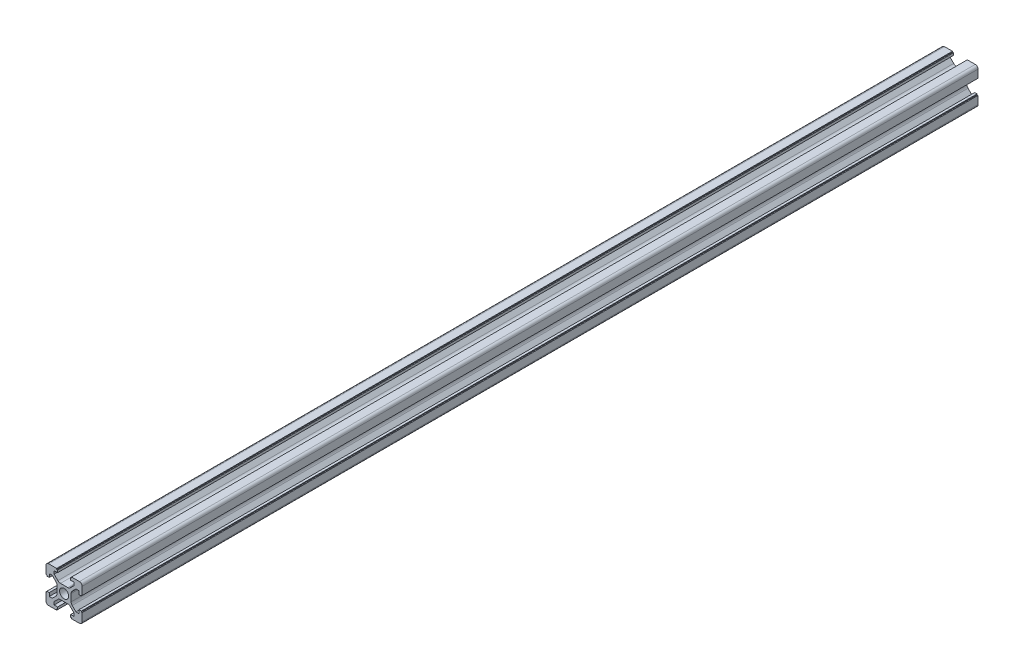
from build123d import *

# Parameters (mm, degrees)
SKETCH1_R           = 2.5
BOSS_EXTRUDE2_DEPTH = 495


with BuildPart() as part:
    # Sketch1 → Boss-Extrude2 (new body)
    with BuildSketch(Plane.XY):
        with BuildLine():
            Line((10, -4.1), (10, -8.5))
            ThreePointArc((10, -8.5), (9.560660172, -9.560660172), (8.5, -10))
            Line((8.5, -10), (4.1, -10))
            Line((4.1, -10), (4.1, -9.5))
            Line((4.1, -9.5), (3.6, -9.5))
            Line((3.6, -9.5), (3.6, -8.2))
            Line((3.6, -8.2), (5.5, -8.2))
            Line((5.5, -8.2), (5.5, -6.560660172))
            Line((5.5, -6.560660172), (3.425126266, -4.485786438))
            ThreePointArc((3.425126266, -4.485786438), (2.776279568, -4.052240935), (2.010912703, -3.9))
            Line((2.010912703, -3.9), (-2.010912703, -3.9))
            ThreePointArc((-2.010912703, -3.9), (-2.776279568, -4.052240935), (-3.425126266, -4.485786438))
            Line((-3.425126266, -4.485786438), (-5.5, -6.560660172))
            Line((-5.5, -6.560660172), (-5.5, -8.2))
            Line((-5.5, -8.2), (-3.6, -8.2))
            Line((-3.6, -8.2), (-3.6, -9.5))
            Line((-3.6, -9.5), (-4.1, -9.5))
            Line((-4.1, -9.5), (-4.1, -10))
            Line((-4.1, -10), (-8.5, -10))
            ThreePointArc((-8.5, -10), (-9.560660172, -9.560660172), (-10, -8.5))
            Line((-10, -8.5), (-10, -4.1))
            Line((-10, -4.1), (-9.5, -4.1))
            Line((-9.5, -4.1), (-9.5, -3.6))
            Line((-9.5, -3.6), (-8.2, -3.6))
            Line((-8.2, -3.6), (-8.2, -5.5))
            Line((-8.2, -5.5), (-6.560660172, -5.5))
            Line((-6.560660172, -5.5), (-4.485786438, -3.425126266))
            ThreePointArc((-4.485786438, -3.425126266), (-4.052240935, -2.776279568), (-3.9, -2.010912703))
            Line((-3.9, -2.010912703), (-3.9, 2.010912703))
            ThreePointArc((-3.9, 2.010912703), (-4.052240935, 2.776279568), (-4.485786438, 3.425126266))
            Line((-4.485786438, 3.425126266), (-6.560660172, 5.5))
            Line((-6.560660172, 5.5), (-8.2, 5.5))
            Line((-8.2, 5.5), (-8.2, 3.6))
            Line((-8.2, 3.6), (-9.5, 3.6))
            Line((-9.5, 3.6), (-9.5, 4.1))
            Line((-9.5, 4.1), (-10, 4.1))
            Line((-10, 4.1), (-10, 8.5))
            ThreePointArc((-10, 8.5), (-9.560660172, 9.560660172), (-8.5, 10))
            Line((-8.5, 10), (-4.1, 10))
            Line((-4.1, 10), (-4.1, 9.5))
            Line((-4.1, 9.5), (-3.6, 9.5))
            Line((-3.6, 9.5), (-3.6, 8.2))
            Line((-3.6, 8.2), (-5.5, 8.2))
            Line((-5.5, 8.2), (-5.5, 6.560660172))
            Line((-5.5, 6.560660172), (-3.425126266, 4.485786438))
            ThreePointArc((-3.425126266, 4.485786438), (-2.776279568, 4.052240935), (-2.010912703, 3.9))
            Line((-2.010912703, 3.9), (2.010912703, 3.9))
            ThreePointArc((2.010912703, 3.9), (2.776279568, 4.052240935), (3.425126266, 4.485786438))
            Line((3.425126266, 4.485786438), (5.5, 6.560660172))
            Line((5.5, 6.560660172), (5.5, 8.2))
            Line((5.5, 8.2), (3.6, 8.2))
            Line((3.6, 8.2), (3.6, 9.5))
            Line((3.6, 9.5), (4.1, 9.5))
            Line((4.1, 9.5), (4.1, 10))
            Line((4.1, 10), (8.5, 10))
            ThreePointArc((8.5, 10), (9.560660172, 9.560660172), (10, 8.5))
            Line((10, 8.5), (10, 4.1))
            Line((10, 4.1), (9.5, 4.1))
            Line((9.5, 4.1), (9.5, 3.6))
            Line((9.5, 3.6), (8.2, 3.6))
            Line((8.2, 3.6), (8.2, 5.5))
            Line((8.2, 5.5), (6.560660172, 5.5))
            Line((6.560660172, 5.5), (4.485786438, 3.425126266))
            ThreePointArc((4.485786438, 3.425126266), (4.052240935, 2.776279568), (3.9, 2.010912703))
            Line((3.9, 2.010912703), (3.9, -2.010912703))
            ThreePointArc((3.9, -2.010912703), (4.052240935, -2.776279568), (4.485786438, -3.425126266))
            Line((4.485786438, -3.425126266), (6.560660172, -5.5))
            Line((6.560660172, -5.5), (8.2, -5.5))
            Line((8.2, -5.5), (8.2, -3.6))
            Line((8.2, -3.6), (9.5, -3.6))
            Line((9.5, -3.6), (9.5, -4.1))
            Line((9.5, -4.1), (10, -4.1))
        make_face()
        Circle(SKETCH1_R, mode=Mode.SUBTRACT)
    extrude(amount=BOSS_EXTRUDE2_DEPTH)


solid = part.part
